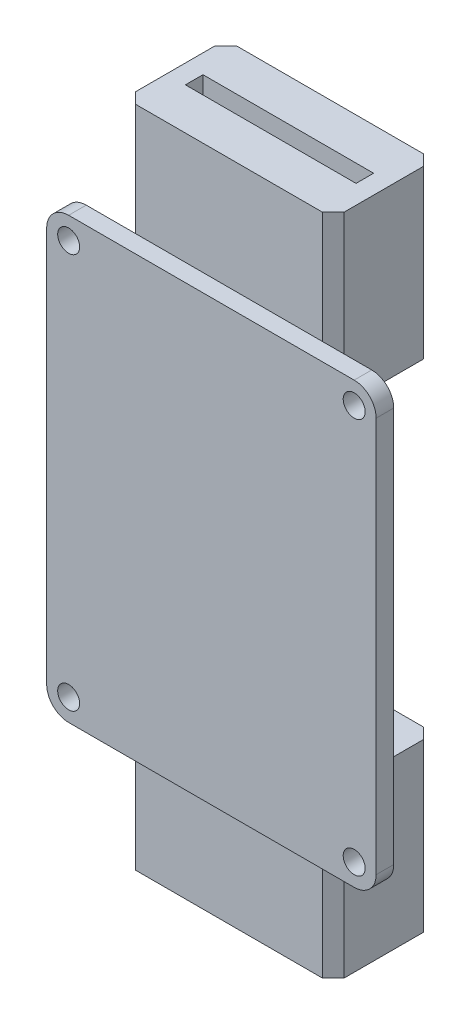
from build123d import *

# Parameters (mm, degrees)
SKETCH_1_R           = 1
EXTRUDE_1_DEPTH      = 1.6
SKETCH_2_W           = 16.45
SKETCH_2_H           = 15.2
SKETCH_2_W_2         = 13.91
EXTRUDE_2_DEPTH      = 9.2
CUT_EXTRUDE_START    = 32.7
CUT_EXTRUDE_1_DEPTH  = 15.2
CUT_EXTRUDE_START_2  = -27.7
CUT_EXTRUDE_2_DEPTH  = 15.2
SKETCH_6_W           = 13
SKETCH_6_H           = 1.6
CUT_EXTRUDE_3_DEPTH  = 9
SKETCH_7_W           = 10.46
SKETCH_7_H           = 1.6
CUT_EXTRUDE_8_DEPTH  = 9
EXTRUDE_START        = 17.5
SKETCH_10_W          = 18.99
SKETCH_10_H          = 9.2
EXTRUDE_5_DEPTH      = 15.2
EXTRUDE_START_2      = -12.5
SKETCH_11_W          = 18.99
SKETCH_11_H          = 9.2
EXTRUDE_6_DEPTH      = 15.2
CUT_EXTRUDE_9_DEPTH  = 60.4
SKETCH_14_W          = 15.54
SKETCH_14_H          = 1.6
CUT_EXTRUDE_10_DEPTH = 9
SKETCH_15_W          = 15.54
SKETCH_15_H          = 1.6
CUT_EXTRUDE_11_DEPTH = 9


with BuildPart() as part:
    # 草图1 → 凸台-拉伸1 (new body)
    with BuildSketch(Plane.XY):
        with BuildLine():
            Line((-13, 22.5), (13, 22.5))
            ThreePointArc((13, 22.5), (14.414213562, 21.914213562), (15, 20.5))
            Line((15, 20.5), (15, -15.5))
            ThreePointArc((15, -15.5), (14.414213562, -16.914213562), (13, -17.5))
            Line((13, -17.5), (-13, -17.5))
            ThreePointArc((-13, -17.5), (-14.414213562, -16.914213562), (-15, -15.5))
            Line((-15, -15.5), (-15, 20.5))
            ThreePointArc((-15, 20.5), (-14.414213562, 21.914213562), (-13, 22.5))
        make_face()
        with Locations((-13, 20.5)):
            Circle(SKETCH_1_R, mode=Mode.SUBTRACT)
        with Locations((13, 20.5)):
            Circle(SKETCH_1_R, mode=Mode.SUBTRACT)
        with Locations((13, -15.5)):
            Circle(SKETCH_1_R, mode=Mode.SUBTRACT)
        with Locations((-13, -15.5)):
            Circle(SKETCH_1_R, mode=Mode.SUBTRACT)
    extrude(amount=EXTRUDE_1_DEPTH)

    # 草图2 → 凸台-拉伸2 (add)
    with BuildSketch(Plane.XY):
        with Locations((0, 25.1)):
            Rectangle(SKETCH_2_W, SKETCH_2_H)
        with Locations((0, -20.1)):
            Rectangle(SKETCH_2_W_2, SKETCH_2_H)
    extrude(amount=-EXTRUDE_2_DEPTH)

    # 草图3 → 切除-拉伸1 (cut)
    with BuildSketch(Plane(origin=(0, 0, 0), x_dir=(1, 0, 0), z_dir=(0, 1, 0)).offset(CUT_EXTRUDE_START)):
        Polygon((-8.225, 9.2), (-7.225, 9.2), (-8.225, 8.2), align=None)
        Polygon((-8.225, 0), (-7.225, 0), (-8.225, 1), align=None)
        Polygon((8.225, 0), (8.225, 1), (7.225, 0), align=None)
        Polygon((8.225, 9.2), (7.225, 9.2), (8.225, 8.2), align=None)
    extrude(amount=-CUT_EXTRUDE_1_DEPTH, mode=Mode.SUBTRACT)

    # 草图4 → 切除-拉伸2 (cut)
    with BuildSketch(Plane(origin=(0, 0, 0), x_dir=(1, 0, 0), z_dir=(0, 1, 0)).offset(CUT_EXTRUDE_START_2)):
        Polygon((-6.955, 0), (-5.955, 0), (-6.955, 1), align=None)
        Polygon((-6.955, 9.2), (-6.955, 8.2), (-5.955, 9.2), align=None)
        Polygon((6.955, 0), (6.955, 1), (5.955, 0), align=None)
        Polygon((6.955, 9.2), (6.955, 8.2), (5.955, 9.2), align=None)
    extrude(amount=CUT_EXTRUDE_2_DEPTH, mode=Mode.SUBTRACT)

    # 草图6 → 切除-拉伸3 (cut)
    with BuildSketch(Plane(origin=(0, 0, 0), x_dir=(1, 0, 0), z_dir=(0, 1, 0)).offset(CUT_EXTRUDE_START)):
        with Locations((0, 4.6)):
            Rectangle(SKETCH_6_W, SKETCH_6_H)
    extrude(amount=-CUT_EXTRUDE_3_DEPTH, mode=Mode.SUBTRACT)

    # 草图7 → 切除-拉伸8 (cut)
    with BuildSketch(Plane(origin=(0, 0, 0), x_dir=(1, 0, 0), z_dir=(0, 1, 0)).offset(CUT_EXTRUDE_START_2)):
        with Locations((0, 4.6)):
            Rectangle(SKETCH_7_W, SKETCH_7_H)
    extrude(amount=CUT_EXTRUDE_8_DEPTH, mode=Mode.SUBTRACT)

    # 草图10 → 凸台-拉伸5 (add)
    with BuildSketch(Plane(origin=(0, 0, 0), x_dir=(1, 0, 0), z_dir=(0, 1, 0)).offset(EXTRUDE_START)):
        with Locations((0, 4.6)):
            Rectangle(SKETCH_10_W, SKETCH_10_H)
    extrude(amount=EXTRUDE_5_DEPTH)

    # 草图11 → 凸台-拉伸6 (add)
    with BuildSketch(Plane(origin=(0, 0, 0), x_dir=(1, 0, 0), z_dir=(0, 1, 0)).offset(EXTRUDE_START_2)):
        with Locations((0, 4.6)):
            Rectangle(SKETCH_11_W, SKETCH_11_H)
    extrude(amount=-EXTRUDE_6_DEPTH)

    # 草图12 → 切除-拉伸9 (cut)
    with BuildSketch(Plane(origin=(0, 0, 0), x_dir=(1, 0, 0), z_dir=(0, 1, 0)).offset(CUT_EXTRUDE_START)):
        Polygon((-9.495, 9.2), (-8.495, 9.2), (-9.495, 8.2), align=None)
        Polygon((-9.495, 0), (-8.495, 0), (-9.495, 1), align=None)
        Polygon((9.495, 9.2), (8.495, 9.2), (9.495, 8.2), align=None)
        Polygon((9.495, 0), (9.495, 1), (8.495, 0), align=None)
    extrude(amount=-CUT_EXTRUDE_9_DEPTH, mode=Mode.SUBTRACT)

    # 草图14 → 切除-拉伸10 (cut)
    with BuildSketch(Plane(origin=(0, 0, 0), x_dir=(1, 0, 0), z_dir=(0, 1, 0)).offset(CUT_EXTRUDE_START)):
        with Locations((0, 4.6)):
            Rectangle(SKETCH_14_W, SKETCH_14_H)
    extrude(amount=-CUT_EXTRUDE_10_DEPTH, mode=Mode.SUBTRACT)

    # 草图15 → 切除-拉伸11 (cut)
    with BuildSketch(Plane(origin=(0, 0, 0), x_dir=(1, 0, 0), z_dir=(0, 1, 0)).offset(CUT_EXTRUDE_START_2)):
        with Locations((0, 4.6)):
            Rectangle(SKETCH_15_W, SKETCH_15_H)
    extrude(amount=CUT_EXTRUDE_11_DEPTH, mode=Mode.SUBTRACT)


solid = part.part
